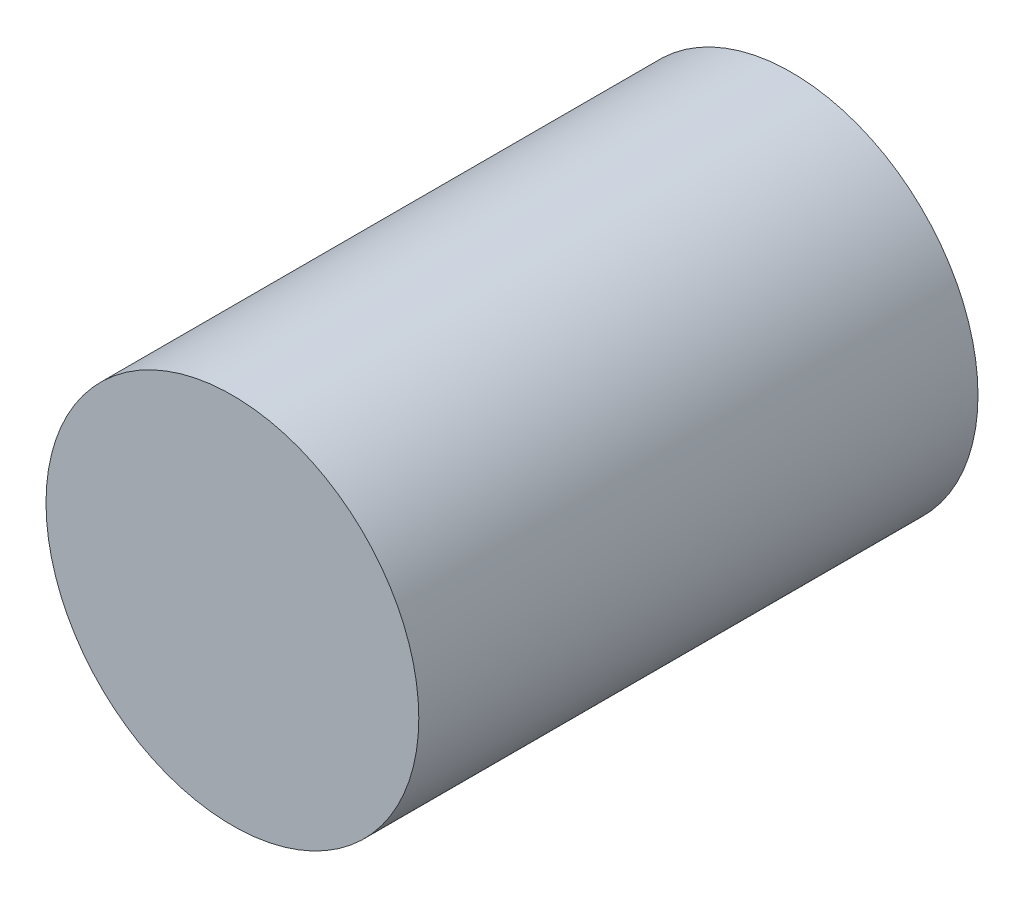
from build123d import *

# Parameters (mm, degrees)
SCHIZZO1_R                   = 50
ESTRUSIONE_ESTRUSIONE1_DEPTH = 150


with BuildPart() as part:
    # Schizzo1 → Estrusione-Estrusione1 (new body)
    with BuildSketch(Plane.XY):
        Circle(SCHIZZO1_R)
    extrude(amount=ESTRUSIONE_ESTRUSIONE1_DEPTH)


solid = part.part
